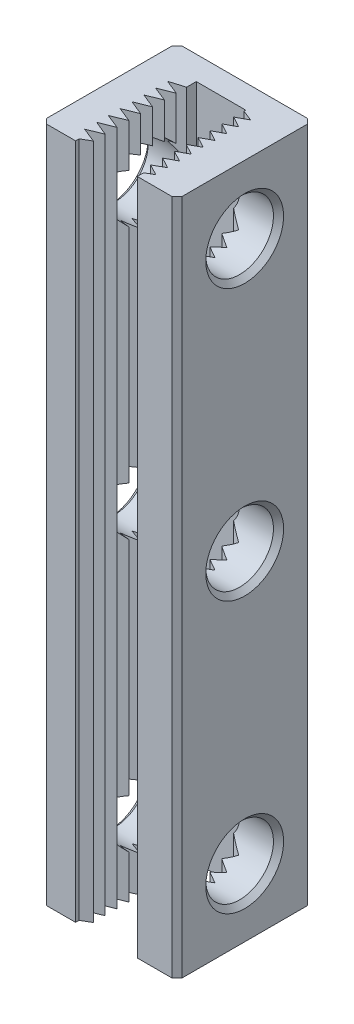
from build123d import *

# Parameters (mm, degrees)
SKETCH1_W                  = 8
SKETCH1_H                  = 8
BOSS_EXTRUDE1_DEPTH        = 300
CUT_EXTRUDE1_DEPTH         = 301.213257535
SKETCH3_R                  = 2
CUT_EXTRUDE2_DEPTH         = 301.213257535
CHAMFER1_SIZE              = 0.3
CHAMFER2_SIZE              = 0.3
LPATTERN1_COUNT            = 19
LPATTERN1_PITCH            = 16
CHAMFER1_OF_LPATTERN1_SIZE = 0.3
SKETCH4_W                  = 8
SKETCH4_H                  = 260
CUT_EXTRUDE3_DEPTH         = 301.213257535


with BuildPart() as part:
    # Sketch1 → Boss-Extrude1 (new body)
    with BuildSketch(Plane(origin=(0, 0, 0), x_dir=(1, 0, 0), z_dir=(0, 1, 0))):
        with Locations((4, 4)):
            Rectangle(SKETCH1_W, SKETCH1_H)
    extrude(amount=BOSS_EXTRUDE1_DEPTH)

    # Sketch2 → Cut-Extrude1 (cut, through all)
    with BuildSketch(Plane.XZ):
        Polygon((5.652029979, 0), (2.008445554, 0), (2.008445554, -0.208206305), (2.54, -0.515099407), (1.673719601, -0.865099407), (2.54, -1.215099407), (1.673719601, -1.572712655), (2.54, -1.915099407), (1.673719601, -2.265099407), (2.54, -2.615099407), (1.673719601, -2.965099407), (2.54, -3.315099407), (1.673719601, -3.665099407), (2.54, -4.015099407), (1.673719601, -4.365099407), (2.54, -4.715099407), (1.673719601, -5.065099407), (2.54, -5.415099407), (1.673719601, -5.765099407), (2.54, -6.026380467), (2.54, -6.6), (5.46, -6.6), (5.46, -6.49878106), (6.106693316, -6.2375), (5.46, -5.8875), (6.106693316, -5.5375), (5.46, -5.1875), (6.106693316, -4.8375), (5.46, -4.4875), (6.106693316, -4.1375), (5.46, -3.7875), (6.106693316, -3.4375), (5.46, -3.0875), (6.106693316, -2.7375), (5.46, -2.3875), (6.106693316, -2.0375), (5.46, -1.6875), (6.106693316, -1.345113247), (5.46, -0.9875), (6.106693316, -0.6375), (5.652029979, -0.375), align=None)
    extrude(amount=-CUT_EXTRUDE1_DEPTH, mode=Mode.SUBTRACT)

    # Sketch3 → Cut-Extrude2 (cut, through all)
    with BuildSketch(Plane(origin=(8, 0, 0), x_dir=(0, 0, -1), z_dir=(1, 0, 0))):
        with Locations((4, 4)):
            Circle(SKETCH3_R)
    cut_extrude2 = extrude(amount=-CUT_EXTRUDE2_DEPTH, mode=Mode.SUBTRACT)

    # Chamfer1
    chamfer1_edges = [part.edges().sort_by_distance(p)[0] for p in [
        (0, 4, -2),
        (8, 4, -2),
    ]]
    chamfer(chamfer1_edges, length=CHAMFER1_SIZE)

    # Chamfer2
    chamfer2_edges = [part.edges().sort_by_distance(p)[0] for p in [
        (0, 150, -8),
        (8, 150, -8),
        (8, 150, 0),
        (0, 150, 0),
    ]]
    chamfer(chamfer2_edges, length=CHAMFER2_SIZE)

    # LPattern1: Cut-Extrude2 ×19
    with Locations(*[(0, i * LPATTERN1_PITCH, 0) for i in range(1, LPATTERN1_COUNT)]):
        add(cut_extrude2, mode=Mode.SUBTRACT)

    # Chamfer1 of LPattern1
    chamfer1_of_lpattern1_edges = [part.edges().sort_by_distance(p)[0] for p in [
        (0, 20, -2),
        (8, 20, -2),
        (0, 36, -2),
        (8, 36, -2),
        (0, 52, -2),
        (8, 52, -2),
        (0, 68, -2),
        (8, 68, -2),
        (0, 84, -2),
        (8, 84, -2),
        (0, 100, -2),
        (8, 100, -2),
        (0, 116, -2),
        (8, 116, -2),
        (0, 132, -2),
        (8, 132, -2),
        (0, 148, -2),
        (8, 148, -2),
        (0, 164, -2),
        (8, 164, -2),
        (0, 180, -2),
        (8, 180, -2),
        (0, 196, -2),
        (8, 196, -2),
        (0, 212, -2),
        (8, 212, -2),
        (0, 228, -2),
        (8, 228, -2),
        (0, 244, -2),
        (8, 244, -2),
        (0, 260, -2),
        (8, 260, -2),
        (0, 276, -2),
        (8, 276, -2),
        (0, 292, -2),
        (8, 292, -2),
    ]]
    chamfer(chamfer1_of_lpattern1_edges, length=CHAMFER1_OF_LPATTERN1_SIZE)

    # Sketch4 → Cut-Extrude3 (cut, through all)
    with BuildSketch(Plane(origin=(8, 0, 0), x_dir=(0, 0, -1), z_dir=(1, 0, 0))):
        with Locations((4, 170)):
            Rectangle(SKETCH4_W, SKETCH4_H)
    extrude(amount=-CUT_EXTRUDE3_DEPTH, mode=Mode.SUBTRACT)


solid = part.part
